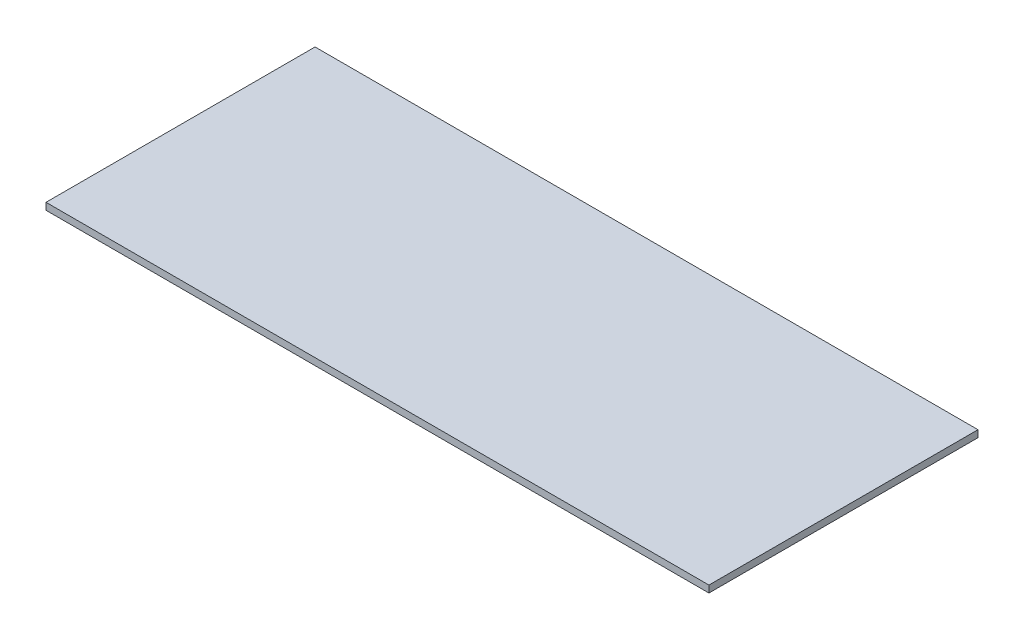
from build123d import *

# Parameters (mm, degrees)
SKETCH1_W           = 455.3
SKETCH1_H           = 184.792366
BOSS_EXTRUDE2_DEPTH = 4.7625


with BuildPart() as part:
    # Sketch1 → Boss-Extrude2 (new body)
    with BuildSketch(Plane(origin=(0, 0, 0), x_dir=(1, 0, 0), z_dir=(0, 1, 0))):
        with Locations((168.521051813, 63.995664579)):
            Rectangle(SKETCH1_W, SKETCH1_H)
    extrude(amount=BOSS_EXTRUDE2_DEPTH)


solid = part.part
